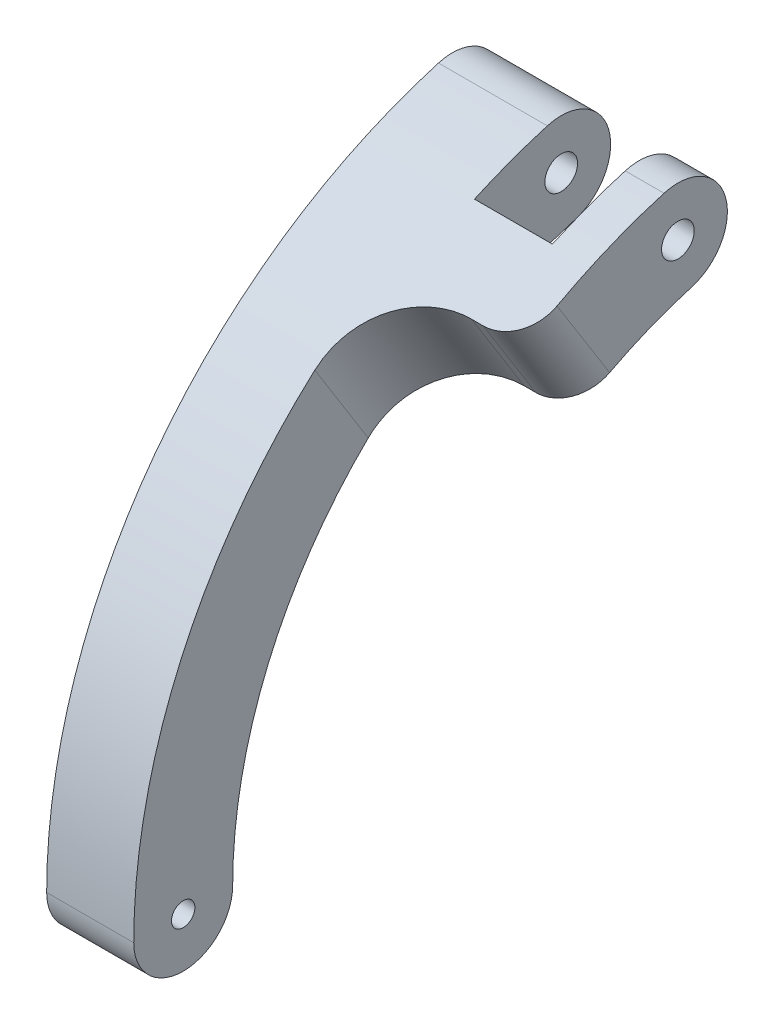
from build123d import *

# Parameters (mm, degrees)
ESQUISSE1_R             = 0.750000000000002
ESQUISSE1_R_2           = 1.05
BOSS_EXTRU_1_DEPTH      = 5.588
BOSS_EXTRU_2_DEPTH      = 8.889999999999999
ENL_V_MAT_EXTRU_1_DEPTH = 2.5
ESQUISSE4_R             = 1.05
ENL_V_MAT_EXTRU_2_DEPTH = 51.616470975365324
CONG_1_R                = 5.588
CONG_2_R                = 2.54


with BuildPart() as part:
    # Esquisse1 → Boss.-Extru.1 (new body)
    with BuildSketch(Plane(origin=(0, 0, 0), x_dir=(0, 0, -1), z_dir=(1, 0, 0))):
        with BuildLine():
            ThreePointArc((-28.574999999999996, 0), (-22.86, 17.144999999999996), (-8.00099999999999, 27.432000000000002))
            ThreePointArc((-8.00099999999999, 27.432000000000002), (-5.841999999999989, 31.369000000000003), (-9.778999999999986, 33.528))
            ThreePointArc((-9.778999999999986, 33.528), (-27.939999999999998, 20.955), (-34.925, 0))
            ThreePointArc((-34.925, 0), (-31.75, -3.174999999999997), (-28.574999999999996, 0))
        make_face()
        with Locations((-31.75, 0)):
            Circle(ESQUISSE1_R, mode=Mode.SUBTRACT)
        with Locations((-8.889999999999992, 30.480000000000004)):
            Circle(ESQUISSE1_R_2, mode=Mode.SUBTRACT)
    extrude(amount=BOSS_EXTRU_1_DEPTH)

    # Esquisse2 → Boss.-Extru.2 (add)
    with BuildSketch(Plane(origin=(5.588, 0, 0), x_dir=(0, 0, -1), z_dir=(1, 0, 0))):
        with BuildLine():
            Line((-15.468698222001095, 24.026027560057866), (-18.836262664685126, 29.410046477810756))
            ThreePointArc((-18.836262664685126, 29.410046477810756), (-14.455023336022604, 31.793205647670106), (-9.778999999999986, 33.528000000000006))
            ThreePointArc((-9.778999999999986, 33.528000000000006), (-5.8419999999999845, 31.369000000000003), (-8.000999999999987, 27.432))
            ThreePointArc((-8.000999999999987, 27.432), (-11.85777574941277, 25.9985341755384), (-15.468698222001095, 24.026027560057866))
        make_face()
    extrude(amount=BOSS_EXTRU_2_DEPTH)

    # Esquisse3 → Enlèv. mat.-Extru.1 (cut, symmetric)
    with BuildSketch(Plane(origin=(9.48778000002064, 7.1644e-12, -3.06684e-12), x_dir=(-1.3e-16, 0, -1), z_dir=(1, 2.5e-16, -1.3e-16))):
        with BuildLine():
            Line((-11.857775749410594, 25.998534175533624), (-14.45502333602043, 31.793205647665314))
            ThreePointArc((-14.45502333602043, 31.793205647665314), (-12.148018341439471, 32.744179259460076), (-9.779000000003055, 33.527999999992836))
            ThreePointArc((-9.779000000003055, 33.527999999992836), (-5.842000000003054, 31.368999999992838), (-8.001000000003058, 27.431999999992833))
            ThreePointArc((-8.001000000003058, 27.431999999992833), (-9.955222229254764, 26.784775066552804), (-11.857775749410594, 25.998534175533624))
        make_face()
    extrude(amount=ENL_V_MAT_EXTRU_1_DEPTH, both=True, mode=Mode.SUBTRACT)

    # Esquisse4 → Enlèv. mat.-Extru.2 (cut, through all)
    with BuildSketch(Plane.ZY):
        with Locations(Location((8.889999999999992, 30.480000000000004, 0), (0, 0, 90))):
            Circle(ESQUISSE4_R)
    extrude(amount=-ENL_V_MAT_EXTRU_2_DEPTH, mode=Mode.SUBTRACT)

    # Congé1
    cong_1_edges = [part.edges().sort_by_distance(p)[0] for p in [
        (5.588, 26.71803701893431, 17.152480443343112),
    ]]
    fillet(cong_1_edges, radius=CONG_1_R)

    # Congé2
    cong_2_edges = [part.edges().sort_by_distance(p)[0] for p in [
        (14.477999999999998, 26.71803701893431, 17.152480443343112),
    ]]
    fillet(cong_2_edges, radius=CONG_2_R)


solid = part.part
